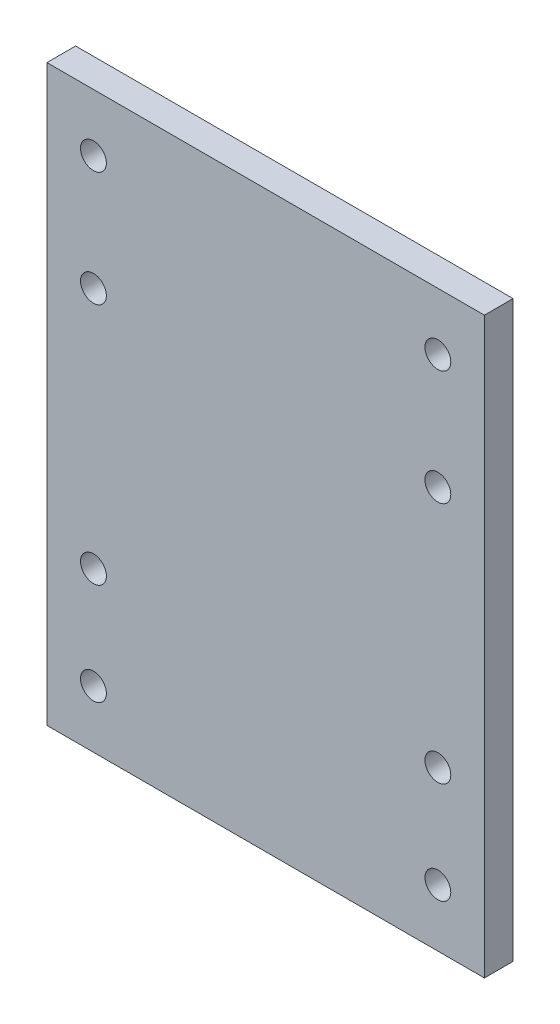
from build123d import *

# Parameters (mm, degrees)
SKETCH1_W                = 76.21
SKETCH1_H                = 100
BOSS_EXTRUDE1_DEPTH      = 5
M4_CLEARANCE_HOLE1_D     = 4.5
M4_CLEARANCE_HOLE1_DEPTH = 5
M4_CLEARANCE_HOLE1_TIP   = 1.351936393


with BuildPart() as part:
    # Sketch1 → Boss-Extrude1 (new body)
    with BuildSketch(Plane.XY):
        with Locations((2.360596056, -12.518477597)):
            Rectangle(SKETCH1_W, SKETCH1_H)
    extrude(amount=BOSS_EXTRUDE1_DEPTH)

    # M4 Clearance Hole1
    with Locations(Plane.XY.offset(5)):
        with Locations((-27.639403944, 7.481522403), (-27.639403944, 27.481522403), (32.360596056, 7.481522403), (32.360596056, 27.481522403), (32.360596056, -52.518477597), (32.360596056, -34.818262245), (-27.639403944, -34.818262245), (-27.639403944, -52.518477597)):
            Hole(M4_CLEARANCE_HOLE1_D / 2, depth=M4_CLEARANCE_HOLE1_DEPTH)
            with Locations((0, 0, -(M4_CLEARANCE_HOLE1_DEPTH + M4_CLEARANCE_HOLE1_TIP / 2))):  # 118° drill point
                Cone(0, M4_CLEARANCE_HOLE1_D / 2, M4_CLEARANCE_HOLE1_TIP, mode=Mode.SUBTRACT)


solid = part.part
